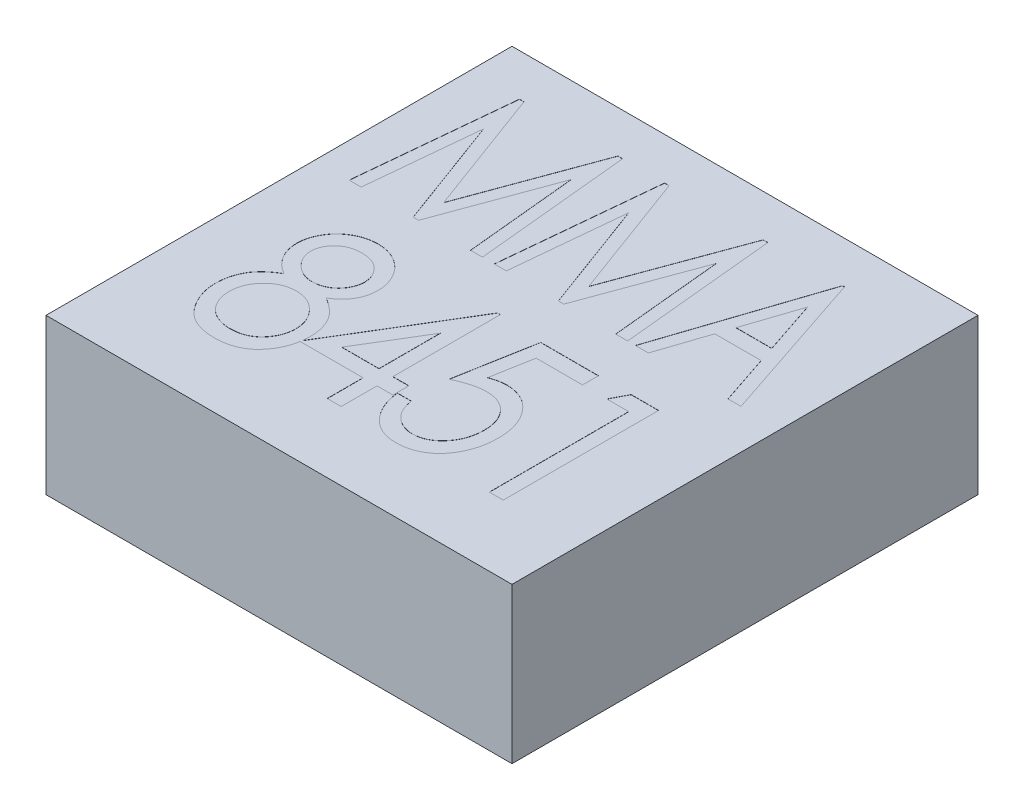
from build123d import *

# Parameters (mm, degrees)
SCHIZZO1_W                   = 3
SCHIZZO1_H                   = 3
ESTRUSIONE_ESTRUSIONE1_DEPTH = 1
TAGLIO_ESTRUSIONE4_DEPTH     = 0.001
TAGLIO_ESTRUSIONE5_DEPTH     = 0.001


with BuildPart() as part:
    # Schizzo1 → Estrusione-Estrusione1 (new body)
    with BuildSketch(Plane(origin=(0, 0, 0), x_dir=(1, 0, 0), z_dir=(0, 1, 0))):
        with Locations((-5.11081678, 9.134792212)):
            Rectangle(SCHIZZO1_W, SCHIZZO1_H)
    extrude(amount=ESTRUSIONE_ESTRUSIONE1_DEPTH)

    # Schizzo2 → Taglio-Estrusione4 (cut)
    # profile 1 of 3: a face of its own
    with BuildSketch(Plane(origin=(0, 1, 0), x_dir=(1, 0, 0), z_dir=(0, 1, 0))):
        Polygon((-6.389008543, 9.364041869), (-6.291853095, 10.364041869), (-6.26280662, 10.364041869), (-5.959521364, 9.543529048), (-5.658038992, 10.364041869), (-5.627790595, 10.364041869), (-5.530034184, 9.364041869), (-5.607157582, 9.364041869), (-5.677470082, 10.081990587), (-5.941091877, 9.364041869), (-5.976348287, 9.364041869), (-6.241572646, 10.081990587), (-6.311284184, 9.364041869), align=None)
    # profile 2 of 3: a face of its own
    with BuildSketch(Plane(origin=(0, 1, 0), x_dir=(1, 0, 0), z_dir=(0, 1, 0))):
        Polygon((-5.454393159, 9.364041869), (-5.35723771, 10.364041869), (-5.328191236, 10.364041869), (-5.024905979, 9.543529048), (-4.723423607, 10.364041869), (-4.69317521, 10.364041869), (-4.5954188, 9.364041869), (-4.672542197, 9.364041869), (-4.742854697, 10.081990587), (-5.006476492, 9.364041869), (-5.041732902, 9.364041869), (-5.306957261, 10.081990587), (-5.3766688, 9.364041869), align=None)
    # profile 3 of 3: a face of its own
    with BuildSketch(Plane(origin=(0, 1, 0), x_dir=(1, 0, 0), z_dir=(0, 1, 0))):
        Polygon((-4.199264954, 10.364041869), (-3.86593162, 9.364041869), (-3.949665595, 9.364041869), (-4.056436428, 9.684554689), (-4.354913992, 9.684554689), (-4.461684825, 9.364041869), (-4.5454188, 9.364041869), (-4.212085466, 10.364041869), align=None)
        Polygon((-4.20567521, 10.132070715), (-4.320659184, 9.787118792), (-4.090691236, 9.787118792), align=None, mode=Mode.SUBTRACT)
    extrude(amount=-TAGLIO_ESTRUSIONE4_DEPTH, mode=Mode.SUBTRACT)

    # Schizzo3 → Taglio-Estrusione5 (cut)
    # profile 1 of 4: a face of its own
    with BuildSketch(Plane(origin=(0, 1, 0), x_dir=(1, 0, 0), z_dir=(0, 1, 0))):
        with BuildLine():
            add(Edge.make_bspline(
                [(-5.805401429, 8.633430289), (-5.798206658, 8.629170193), (-5.784189619, 8.620870564), (-5.764412174, 8.607321523), (-5.746303971, 8.593319187), (-5.729483968, 8.579190127), (-5.714618607, 8.564188308), (-5.701232054, 8.548916536), (-5.689464025, 8.533091902), (-5.675916898, 8.511554233), (-5.662101899, 8.483035691), (-5.650480943, 8.446542374), (-5.643287474, 8.407817504), (-5.642395198, 8.381191552), (-5.64193989, 8.367604968)],
                knots=[0, 0, 0, 0, 0.914362454, 1.781384597, 2.619883779, 3.417600481, 4.181920405, 4.927374046, 5.637276055, 6.336350791, 7.708254165, 9.089438062, 10.514810145, 12, 12, 12, 12], degree=3))
            add(Edge.make_bspline(
                [(-5.64193989, 8.367604968), (-5.642107403, 8.357979344), (-5.642438737, 8.338940232), (-5.64583215, 8.31082975), (-5.650885486, 8.283520919), (-5.6584792, 8.257118309), (-5.667750119, 8.231530079), (-5.679380566, 8.206858298), (-5.69284874, 8.182935867), (-5.7036264, 8.167990607), (-5.709047262, 8.160473558)],
                knots=[0, 0, 0, 0, 1.041882803, 2.060804048, 3.06202158, 4.046332822, 5.03231592, 6.006025776, 6.99708666, 8, 8, 8, 8], degree=3))
            add(Edge.make_bspline(
                [(-5.709047262, 8.160473558), (-5.716050807, 8.151739348), (-5.72991868, 8.134444549), (-5.754125329, 8.112050466), (-5.780404094, 8.092980277), (-5.808936713, 8.077397713), (-5.839734304, 8.065442161), (-5.872706493, 8.056726988), (-5.907883155, 8.051791892), (-5.932055719, 8.051068201), (-5.944423865, 8.050697917)],
                knots=[0, 0, 0, 0, 0.994201578, 1.968640301, 2.92098468, 3.874697238, 4.850310626, 5.851048309, 6.900466311, 8, 8, 8, 8], degree=3))
            add(Edge.make_bspline(
                [(-5.944423865, 8.050697917), (-5.956388835, 8.051023584), (-5.979601874, 8.051655404), (-6.013394622, 8.056029521), (-6.044852279, 8.063670143), (-6.074260615, 8.074017275), (-6.101286377, 8.087760217), (-6.12604527, 8.104520913), (-6.148802693, 8.124080036), (-6.168736379, 8.146731973), (-6.186370908, 8.171048604), (-6.201833935, 8.196199285), (-6.215228796, 8.221804592), (-6.22575547, 8.24824864), (-6.234375611, 8.275103202), (-6.240014512, 8.30272115), (-6.243844287, 8.330839024), (-6.244283075, 8.349830281), (-6.244503993, 8.359391827)],
                knots=[0, 0, 0, 0, 1.189830096, 2.308369381, 3.38102576, 4.403937896, 5.401777142, 6.387120394, 7.37100814, 8.377427796, 9.380226239, 10.35513181, 11.31145126, 12.249850496, 13.182357426, 14.112259914, 15.049577746, 16, 16, 16, 16], degree=3))
            add(Edge.make_bspline(
                [(-6.244503993, 8.359391827), (-6.244043618, 8.373243366), (-6.24314118, 8.400395513), (-6.236000347, 8.440018355), (-6.224063773, 8.477420303), (-6.210311307, 8.506901476), (-6.196820154, 8.52939603), (-6.184640689, 8.54561359), (-6.170985845, 8.561471992), (-6.155688933, 8.576964789), (-6.138675119, 8.591939901), (-6.119901927, 8.606397349), (-6.099539165, 8.620434897), (-6.085035162, 8.629040679), (-6.077637006, 8.633430289)],
                knots=[0, 0, 0, 0, 1.473281155, 2.887963909, 4.267687182, 5.640863319, 6.339108383, 7.055342466, 7.795973019, 8.564700607, 9.370150118, 10.205839621, 11.084840353, 12, 12, 12, 12], degree=3))
            add(Edge.make_bspline(
                [(-6.077637006, 8.633430289), (-6.087828754, 8.639792839), (-6.107757369, 8.652233965), (-6.134005665, 8.674632975), (-6.156485821, 8.699069121), (-6.174485747, 8.725850879), (-6.188570957, 8.754170072), (-6.198652236, 8.783664453), (-6.204916968, 8.81418919), (-6.205665388, 8.834923223), (-6.206042454, 8.845369391)],
                knots=[0, 0, 0, 0, 1.108078529, 2.1667008, 3.174911676, 4.165013377, 5.13557244, 6.087046531, 7.036220656, 8, 8, 8, 8], degree=3))
            add(Edge.make_bspline(
                [(-6.206042454, 8.845369391), (-6.205620126, 8.856021416), (-6.204772685, 8.877395683), (-6.197765666, 8.90918296), (-6.186752424, 8.940579541), (-6.171219852, 8.97101702), (-6.152384535, 9.000040915), (-6.129214051, 9.025710896), (-6.103135141, 9.04855648), (-6.073710855, 9.067570591), (-6.0421322, 9.083010431), (-6.008809939, 9.093840872), (-5.974357508, 9.100757735), (-5.950866959, 9.101570102), (-5.939015211, 9.101979968)],
                knots=[0, 0, 0, 0, 0.933393775, 1.872940412, 2.841657425, 3.844761966, 4.863186887, 5.867009188, 6.867494675, 7.895706246, 8.930319001, 9.941494413, 10.961416858, 12, 12, 12, 12], degree=3))
            add(Edge.make_bspline(
                [(-5.939015211, 9.101979968), (-5.927432011, 9.101565787), (-5.904539643, 9.100747222), (-5.870869853, 9.093912867), (-5.838657161, 9.082578542), (-5.808048902, 9.067127014), (-5.779591061, 9.048078704), (-5.754431118, 9.025162268), (-5.732333369, 8.999301446), (-5.713899195, 8.970587296), (-5.699107365, 8.939955473), (-5.688106176, 8.908279396), (-5.681770982, 8.875601746), (-5.680859247, 8.853608549), (-5.680401429, 8.842564904)],
                knots=[0, 0, 0, 0, 1.025177658, 2.026102131, 3.028615222, 4.041574873, 5.055259337, 6.051788893, 7.046052148, 8.059822865, 9.064931678, 10.052400243, 11.022033903, 12, 12, 12, 12], degree=3))
            add(Edge.make_bspline(
                [(-5.680401429, 8.842564904), (-5.680787269, 8.831721751), (-5.681543298, 8.810475312), (-5.687460751, 8.779507191), (-5.697361105, 8.750409133), (-5.711099022, 8.723050498), (-5.728887646, 8.697650256), (-5.750776404, 8.674249086), (-5.776152571, 8.652234717), (-5.795482402, 8.639807345), (-5.805401429, 8.633430289)],
                knots=[0, 0, 0, 0, 1.017158402, 1.993054549, 2.946292347, 3.893578809, 4.856714948, 5.845702908, 6.894530941, 8, 8, 8, 8], degree=3))
        make_face()
        with BuildLine():
            add(Edge.make_bspline(
                [(-5.943622583, 8.999415865), (-5.949702799, 8.99922947), (-5.961628598, 8.998863873), (-5.979158358, 8.996950358), (-5.995827836, 8.993259688), (-6.011800764, 8.988348057), (-6.026819838, 8.981528645), (-6.041371672, 8.973897592), (-6.054807031, 8.964296122), (-6.067369345, 8.95359033), (-6.078630236, 8.941800699), (-6.088812747, 8.92961455), (-6.097231454, 8.916652949), (-6.104340251, 8.903223407), (-6.109730845, 8.889155695), (-6.113592795, 8.874588261), (-6.115800568, 8.859459502), (-6.116131119, 8.849182463), (-6.116298865, 8.843967148)],
                knots=[0, 0, 0, 0, 1.128425343, 2.213305224, 3.265437279, 4.291949646, 5.307035918, 6.32144161, 7.335317645, 8.363249344, 9.379544413, 10.356652003, 11.304985507, 12.241430786, 13.170884807, 14.093377769, 15.032441564, 16, 16, 16, 16], degree=3))
            add(Edge.make_bspline(
                [(-6.116298865, 8.843967148), (-6.116147553, 8.838749941), (-6.115849091, 8.828459052), (-6.113375396, 8.813185088), (-6.109123134, 8.798364446), (-6.10329129, 8.783855503), (-6.095752231, 8.769749915), (-6.086803672, 8.755929369), (-6.075984138, 8.74258576), (-6.06376469, 8.72981948), (-6.05050374, 8.717881038), (-6.036494851, 8.707357586), (-6.021689304, 8.69875267), (-6.006508143, 8.691498), (-5.990745368, 8.685822205), (-5.974432141, 8.68183031), (-5.957587276, 8.679357206), (-5.946168342, 8.679055162), (-5.940417454, 8.678903045)],
                knots=[0, 0, 0, 0, 0.941109226, 1.856328975, 2.783214069, 3.718519893, 4.672576731, 5.66519449, 6.685154655, 7.767547646, 8.851281227, 9.90202341, 10.922908451, 11.936227576, 12.934824575, 13.940159871, 14.962608181, 16, 16, 16, 16], degree=3))
            add(Edge.make_bspline(
                [(-5.940417454, 8.678903045), (-5.932983099, 8.679152929), (-5.918181402, 8.679650445), (-5.896423773, 8.684267793), (-5.875322763, 8.69159566), (-5.85502666, 8.701537241), (-5.83604091, 8.713988028), (-5.81932112, 8.729091263), (-5.804457573, 8.745935226), (-5.792420652, 8.765002878), (-5.782807934, 8.784969903), (-5.775323802, 8.805151628), (-5.770992543, 8.82555292), (-5.770425754, 8.839207245), (-5.770145018, 8.845970353)],
                knots=[0, 0, 0, 0, 1.013084994, 2.017038092, 3.019502504, 4.054223377, 5.092546353, 6.10542658, 7.119125627, 8.147492291, 9.170033384, 10.138140416, 11.077804571, 12, 12, 12, 12], degree=3))
            add(Edge.make_bspline(
                [(-5.770145018, 8.845970353), (-5.770698576, 8.855375416), (-5.771803464, 8.874147696), (-5.780406477, 8.90164108), (-5.794955075, 8.927506154), (-5.810755526, 8.947870987), (-5.826221149, 8.962525713), (-5.839197421, 8.972589069), (-5.853598697, 8.980865141), (-5.869210228, 8.987832637), (-5.886074572, 8.992877515), (-5.904138357, 8.996813105), (-5.923474343, 8.998911444), (-5.936807319, 8.999245242), (-5.943622583, 8.999415865)],
                knots=[0, 0, 0, 0, 1.307320902, 2.609381067, 3.96494532, 5.420448181, 6.176278048, 6.925223031, 7.699726536, 8.48182856, 9.298861196, 10.144453644, 11.051521825, 12, 12, 12, 12], degree=3))
        make_face(mode=Mode.SUBTRACT)
        with BuildLine():
            add(Edge.make_bspline(
                [(-5.93861457, 8.576338942), (-5.946107111, 8.576175918), (-5.960896192, 8.575854134), (-5.982528304, 8.57242497), (-6.003339699, 8.567580457), (-6.023146676, 8.560244209), (-6.042003469, 8.550809009), (-6.059942564, 8.539255224), (-6.077024566, 8.525818451), (-6.09290528, 8.510438834), (-6.1073665, 8.493804636), (-6.120135233, 8.476297767), (-6.130764327, 8.458020565), (-6.139459132, 8.439020888), (-6.14622731, 8.419351047), (-6.151390755, 8.399013681), (-6.154124727, 8.377896317), (-6.154547073, 8.363605445), (-6.154760403, 8.356387019)],
                knots=[0, 0, 0, 0, 1.048421666, 2.069416987, 3.060597679, 4.036932712, 5.019740262, 6.008093548, 7.02022806, 8.058591887, 9.099311237, 10.103813435, 11.088621048, 12.055279132, 13.02532386, 13.998339084, 14.988946113, 16, 16, 16, 16], degree=3))
            add(Edge.make_bspline(
                [(-6.154760403, 8.356387019), (-6.154484692, 8.347412432), (-6.1539391, 8.329653021), (-6.148557423, 8.303446915), (-6.140493833, 8.277927163), (-6.128756819, 8.253559595), (-6.114426589, 8.230796862), (-6.096815811, 8.210670123), (-6.076802723, 8.193170764), (-6.054100996, 8.178657159), (-6.029242278, 8.167185704), (-6.002287914, 8.159324359), (-5.97360994, 8.154035891), (-5.953797214, 8.153524592), (-5.943622583, 8.153262019)],
                knots=[0, 0, 0, 0, 0.983353418, 1.945914075, 2.923520839, 3.913075695, 4.904716137, 5.865351531, 6.836321414, 7.811675056, 8.811399656, 9.82878879, 10.884995781, 12, 12, 12, 12], degree=3))
            add(Edge.make_bspline(
                [(-5.943622583, 8.153262019), (-5.935734084, 8.153450484), (-5.920231911, 8.153820848), (-5.897677144, 8.156831419), (-5.876338199, 8.161881269), (-5.856338714, 8.168880207), (-5.83740231, 8.177763041), (-5.819865393, 8.188743304), (-5.803550517, 8.201804502), (-5.788783843, 8.216707933), (-5.775386682, 8.232876999), (-5.763737455, 8.249926578), (-5.753921765, 8.267675853), (-5.745577683, 8.285883115), (-5.739341373, 8.304914755), (-5.735050938, 8.324590877), (-5.732009844, 8.344941692), (-5.731793352, 8.358779323), (-5.73168348, 8.365802083)],
                knots=[0, 0, 0, 0, 1.127389244, 2.215501698, 3.245805524, 4.257141659, 5.239223727, 6.229804829, 7.207749447, 8.220211165, 9.223632865, 10.205900477, 11.167354178, 12.120096853, 13.064916475, 14.023665393, 14.996987016, 16, 16, 16, 16], degree=3))
            add(Edge.make_bspline(
                [(-5.73168348, 8.365802083), (-5.731886422, 8.372622294), (-5.73228609, 8.386053846), (-5.735155298, 8.405932353), (-5.739992116, 8.425170408), (-5.746636396, 8.443882945), (-5.75507325, 8.46204025), (-5.765567394, 8.479545249), (-5.778079382, 8.496358436), (-5.792177372, 8.512476258), (-5.8075905, 8.527287346), (-5.823900412, 8.540537506), (-5.841165723, 8.551498214), (-5.859113429, 8.560643078), (-5.877861697, 8.567688473), (-5.897405049, 8.572686345), (-5.917748909, 8.575785942), (-5.931592297, 8.576152832), (-5.93861457, 8.576338942)],
                knots=[0, 0, 0, 0, 1.001088024, 1.971517479, 2.94155076, 3.908905619, 4.882498667, 5.876071198, 6.899515427, 7.955402232, 9.016146846, 10.034225051, 11.034929039, 12.012560479, 12.98664691, 13.968593758, 14.969537786, 16, 16, 16, 16], degree=3))
        make_face(mode=Mode.SUBTRACT)
    # profile 2 of 4: a face of its own
    with BuildSketch(Plane(origin=(0, 1, 0), x_dir=(1, 0, 0), z_dir=(0, 1, 0))):
        Polygon((-5.170425467, 9.101979968), (-5.1521963, 9.101979968), (-5.1521963, 8.409672276), (-5.049632198, 8.409672276), (-5.049632198, 8.307108173), (-5.1521963, 8.307108173), (-5.1521963, 8.076338942), (-5.24193989, 8.076338942), (-5.24193989, 8.307108173), (-5.6521963, 8.307108173), align=None)
        Polygon((-5.24193989, 8.409672276), (-5.24193989, 8.804504007), (-5.481122583, 8.409672276), align=None, mode=Mode.SUBTRACT)
    # profile 3 of 4: a face of its own
    with BuildSketch(Plane(origin=(0, 1, 0), x_dir=(1, 0, 0), z_dir=(0, 1, 0))):
        with BuildLine():
            Line((-4.495786044, 9.076338942), (-4.495786044, 8.97377484))
            Line((-4.495786044, 8.97377484), (-4.794463929, 8.97377484))
            Line((-4.794463929, 8.97377484), (-4.84193989, 8.709151442))
            add(Edge.make_bspline(
                [(-4.84193989, 8.709151442), (-4.83283674, 8.71236523), (-4.815285122, 8.718561675), (-4.789170667, 8.725231514), (-4.76440368, 8.729199042), (-4.748336155, 8.729864008), (-4.740577711, 8.730185096)],
                knots=[0, 0, 0, 0, 1.113143318, 2.146231409, 3.104880253, 4, 4, 4, 4], degree=3))
            add(Edge.make_bspline(
                [(-4.740577711, 8.730185096), (-4.730944291, 8.729944926), (-4.712039273, 8.729473607), (-4.684428462, 8.724900325), (-4.658112237, 8.717633035), (-4.633043187, 8.707692335), (-4.609286723, 8.69462713), (-4.586853298, 8.678765722), (-4.565638236, 8.66000409), (-4.546228087, 8.638308006), (-4.528264542, 8.614782781), (-4.512723236, 8.589225213), (-4.499547064, 8.562192915), (-4.488551987, 8.533551674), (-4.480512749, 8.503154127), (-4.4744641, 8.471232727), (-4.470803427, 8.437668619), (-4.47036751, 8.414756192), (-4.470145018, 8.403061699)],
                knots=[0, 0, 0, 0, 0.973560614, 1.910555428, 2.821466426, 3.73059852, 4.631163213, 5.556699778, 6.503883695, 7.488691105, 8.49622651, 9.493389215, 10.5081404, 11.534042417, 12.590644417, 13.683294485, 14.817554483, 16, 16, 16, 16], degree=3))
            add(Edge.make_bspline(
                [(-4.470145018, 8.403061699), (-4.470666891, 8.386875656), (-4.471694664, 8.35499894), (-4.479184771, 8.308236933), (-4.491928877, 8.263561167), (-4.506646386, 8.228217288), (-4.5205046, 8.201371497), (-4.531975078, 8.182561996), (-4.544169588, 8.16481295), (-4.557433751, 8.148407139), (-4.571472118, 8.133136312), (-4.586346516, 8.119018607), (-4.602212189, 8.106143665), (-4.619046935, 8.094650363), (-4.636423768, 8.084043108), (-4.654789975, 8.075365442), (-4.673603339, 8.067659086), (-4.693160486, 8.061432389), (-4.713387048, 8.056623693), (-4.734287808, 8.053324521), (-4.755812956, 8.050913878), (-4.770418443, 8.050770663), (-4.777837326, 8.050697917)],
                knots=[0, 0, 0, 0, 1.854240742, 3.651732996, 5.409993055, 7.166221002, 8.028594238, 8.869695635, 9.688937347, 10.494306344, 11.284856283, 12.064219686, 12.842117024, 13.623131146, 14.398616627, 15.171985563, 15.947735206, 16.72687324, 17.521153864, 18.327430933, 19.15041553, 20, 20, 20, 20], degree=3))
            add(Edge.make_bspline(
                [(-4.777837326, 8.050697917), (-4.786601278, 8.050896732), (-4.80388105, 8.051288732), (-4.829204796, 8.055358442), (-4.853643885, 8.061205664), (-4.87692056, 8.069922243), (-4.899201758, 8.080985924), (-4.920201846, 8.094771331), (-4.940439635, 8.110656981), (-4.959321687, 8.129025091), (-4.976645588, 8.149427497), (-4.992332207, 8.17133496), (-5.006239027, 8.194704622), (-5.018217056, 8.219508637), (-5.028297529, 8.245785811), (-5.036440233, 8.273463903), (-5.042939005, 8.302573976), (-5.045675911, 8.322575168), (-5.047068095, 8.332749199)],
                knots=[0, 0, 0, 0, 0.980012484, 1.932278219, 2.86391096, 3.788442921, 4.707522156, 5.642386417, 6.594769441, 7.583067065, 8.584946701, 9.586603339, 10.595260768, 11.624716315, 12.665609409, 13.74146141, 14.851146399, 16, 16, 16, 16], degree=3))
            Line((-5.047068095, 8.332749199), (-4.957324506, 8.332749199))
            add(Edge.make_bspline(
                [(-4.957324506, 8.332749199), (-4.955509668, 8.323221505), (-4.952033562, 8.304972339), (-4.944022746, 8.279356864), (-4.934834217, 8.25627995), (-4.923240235, 8.236024527), (-4.909819319, 8.218081015), (-4.894400764, 8.202165345), (-4.877170894, 8.187821558), (-4.857911189, 8.175739684), (-4.837570936, 8.165673271), (-4.816233514, 8.158722045), (-4.794537385, 8.154001958), (-4.779798344, 8.153508669), (-4.772428672, 8.153262019)],
                knots=[0, 0, 0, 0, 1.237908536, 2.371066588, 3.422813746, 4.404583581, 5.342816831, 6.277826636, 7.229035638, 8.199176782, 9.175745742, 10.119776575, 11.059868941, 12, 12, 12, 12], degree=3))
            add(Edge.make_bspline(
                [(-4.772428672, 8.153262019), (-4.765268633, 8.153496724), (-4.75113393, 8.153960057), (-4.730327367, 8.157543099), (-4.710207705, 8.16298368), (-4.691091761, 8.17130751), (-4.672416622, 8.181127507), (-4.655084836, 8.194106663), (-4.638057105, 8.208688158), (-4.622274202, 8.225646029), (-4.607688817, 8.244178005), (-4.594788181, 8.264048013), (-4.583985155, 8.285147573), (-4.5750941, 8.307332509), (-4.568296078, 8.33062082), (-4.563562167, 8.355035099), (-4.560419677, 8.380544329), (-4.560067972, 8.397977268), (-4.559888608, 8.406867789)],
                knots=[0, 0, 0, 0, 0.933673813, 1.843174603, 2.747905908, 3.645942738, 4.55819341, 5.494019063, 6.463585747, 7.480531844, 8.510567353, 9.537614091, 10.566285436, 11.598455736, 12.651591861, 13.726309059, 14.840453956, 16, 16, 16, 16], degree=3))
            add(Edge.make_bspline(
                [(-4.559888608, 8.406867789), (-4.559996207, 8.414890835), (-4.560206735, 8.430588773), (-4.563207242, 8.453479106), (-4.567487425, 8.475228054), (-4.573749336, 8.495823531), (-4.581795421, 8.515240463), (-4.591368687, 8.533693884), (-4.603110547, 8.550694864), (-4.616332301, 8.56650681), (-4.630846248, 8.581013894), (-4.646932695, 8.593422597), (-4.664200107, 8.603872218), (-4.682438662, 8.612922021), (-4.702196969, 8.619321573), (-4.722947422, 8.624243817), (-4.744910213, 8.627018204), (-4.759934688, 8.627416984), (-4.76762098, 8.627620994)],
                knots=[0, 0, 0, 0, 1.127360635, 2.20580017, 3.240687026, 4.241666562, 5.226843905, 6.192863443, 7.15906549, 8.125632452, 9.088360914, 10.038692719, 10.974299228, 11.923377817, 12.894313054, 13.887334147, 14.919192329, 16, 16, 16, 16], degree=3))
            add(Edge.make_bspline(
                [(-4.76762098, 8.627620994), (-4.77430458, 8.627454873), (-4.788112352, 8.62711168), (-4.809263358, 8.624590929), (-4.831459178, 8.62051938), (-4.854661054, 8.614886034), (-4.878922779, 8.607640043), (-4.904218887, 8.598725526), (-4.930595931, 8.588413053), (-4.948277554, 8.580425726), (-4.957324506, 8.576338942)],
                knots=[0, 0, 0, 0, 0.810269167, 1.673950008, 2.579134618, 3.545268136, 4.567349434, 5.647883586, 6.7965197, 8, 8, 8, 8], degree=3))
            Line((-4.957324506, 8.576338942), (-4.867580916, 9.076338942))
            Line((-4.867580916, 9.076338942), (-4.495786044, 9.076338942))
        make_face()
    # profile 4 of 4: a face of its own
    with BuildSketch(Plane(origin=(0, 1, 0), x_dir=(1, 0, 0), z_dir=(0, 1, 0))):
        Polygon((-4.28568989, 9.076338942), (-4.108606557, 9.076338942), (-4.108606557, 8.076338942), (-4.198350147, 8.076338942), (-4.198350147, 8.97377484), (-4.339375788, 8.97377484), align=None)
    extrude(amount=-TAGLIO_ESTRUSIONE5_DEPTH, mode=Mode.SUBTRACT)


solid = part.part
